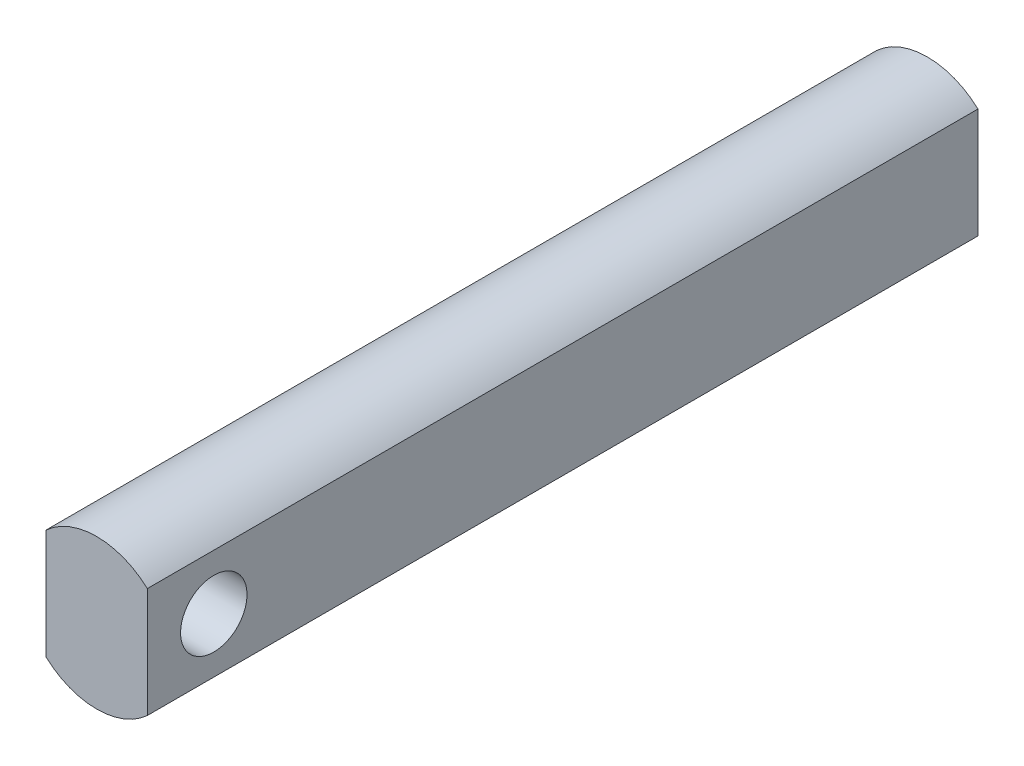
from build123d import *

# Parameters (mm, degrees)
EXTRUDE_1_DEPTH     = 50
SKETCH_2_R          = 2
CUT_EXTRUDE_1_DEPTH = 51.670109532


with BuildPart() as part:
    # Эскиз1 → Бобышка-Вытянуть1 (new body)
    with BuildSketch(Plane.XY):
        with BuildLine():
            Line((-3.05, 2.308700651), (-3.05, -4.308700651))
            ThreePointArc((-3.05, -4.308700651), (0, -5.5), (3.05, -4.308700651))
            Line((3.05, -4.308700651), (3.05, 2.308700651))
            ThreePointArc((3.05, 2.308700651), (0, 3.5), (-3.05, 2.308700651))
        make_face()
    extrude(amount=EXTRUDE_1_DEPTH)

    # Эскиз2 → Вырез-Вытянуть1 (cut, through all)
    with BuildSketch(Plane.ZY.offset(3.05)):
        with Locations(Location((46, -1, 0), (0, 0, 270))):
            Circle(SKETCH_2_R)
    extrude(amount=-CUT_EXTRUDE_1_DEPTH, mode=Mode.SUBTRACT)


solid = part.part
